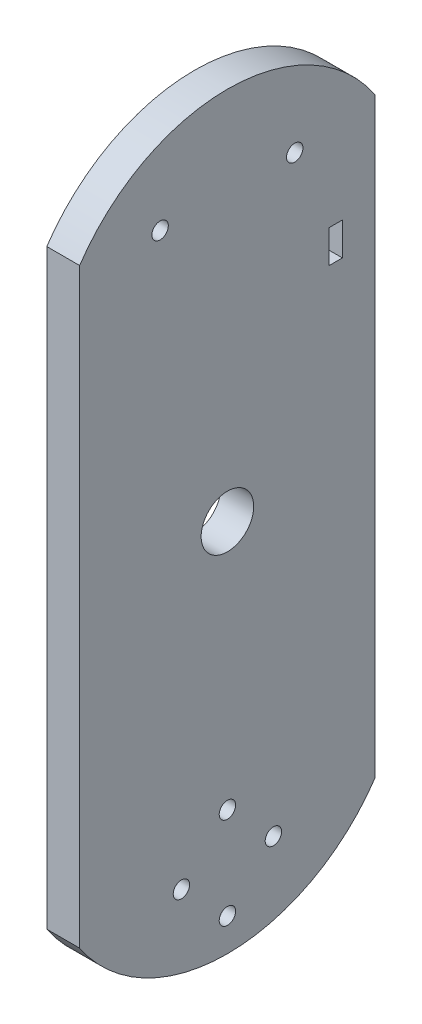
from build123d import *

# Parameters (mm, degrees)
SKETCH1_R           = 1.25
SKETCH1_R_2         = 4
SKETCH1_W           = 2
SKETCH1_H           = 5
BOSS_EXTRUDE1_DEPTH = 5


with BuildPart() as part:
    # Sketch1 → Boss-Extrude1 (new body)
    with BuildSketch(Plane(origin=(0, 0, 0), x_dir=(0, 0, -1), z_dir=(1, 0, 0))):
        with BuildLine():
            Line((-22.5, 0), (-22.5, 90))
            ThreePointArc((-22.5, 90), (0, 102), (22.5, 90))
            Line((22.5, 90), (22.5, 0))
            ThreePointArc((22.5, 0), (0, -12), (-22.5, 0))
        make_face()
        with Locations((0, 7)):
            Circle(SKETCH1_R, mode=Mode.SUBTRACT)
        with Locations((7, 0)):
            Circle(SKETCH1_R, mode=Mode.SUBTRACT)
        with Locations((0, -7)):
            Circle(SKETCH1_R, mode=Mode.SUBTRACT)
        with Locations((-7, 0)):
            Circle(SKETCH1_R, mode=Mode.SUBTRACT)
        with Locations((-10.25, 88.5)):
            Circle(SKETCH1_R, mode=Mode.SUBTRACT)
        with Locations((10.25, 88.5)):
            Circle(SKETCH1_R, mode=Mode.SUBTRACT)
        with Locations((0, 45)):
            Circle(SKETCH1_R_2, mode=Mode.SUBTRACT)
        with Locations((16.5, 73.5)):
            Rectangle(SKETCH1_W, SKETCH1_H, mode=Mode.SUBTRACT)
    extrude(amount=BOSS_EXTRUDE1_DEPTH)


solid = part.part
